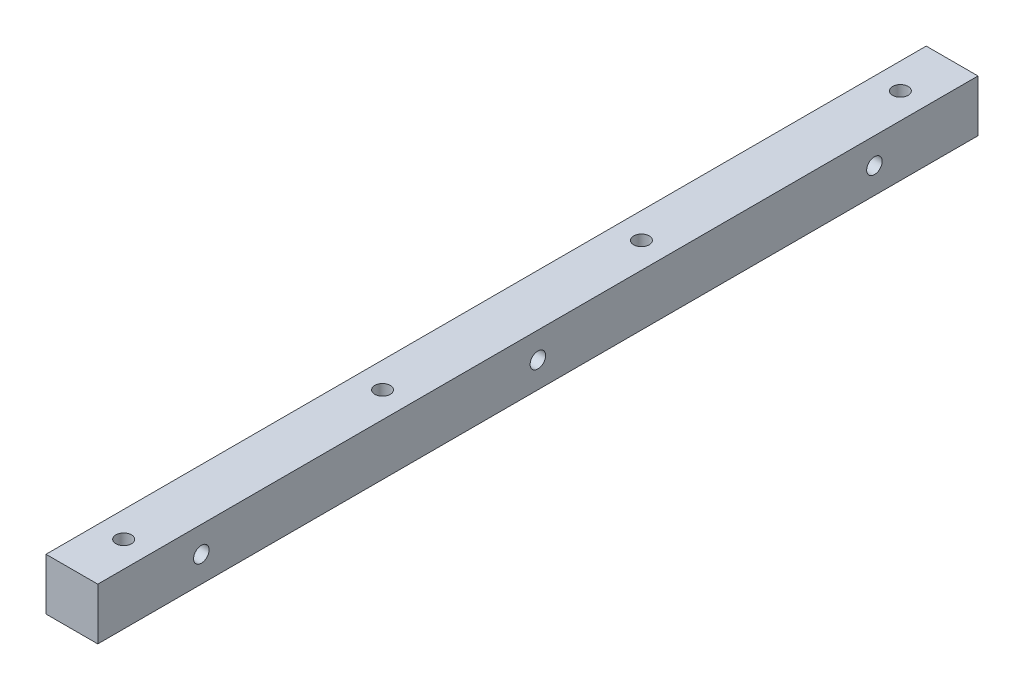
from build123d import *

# Parameters (mm, degrees)
SKETCH1_W          = 10
SKETCH1_H          = 10
EXTRUDE1_DEPTH     = 170
SKETCH4_R          = 1.5
CUT_EXTRUDE3_DEPTH = 171.587221092
LPATTERN1_COUNT    = 4
LPATTERN1_PITCH    = 50
SKETCH5_R          = 1.5
CUT_EXTRUDE4_DEPTH = 171.587221092


with BuildPart() as part:
    # Sketch1 → Extrude1 (new body)
    with BuildSketch(Plane.XY):
        with Locations((5, 5)):
            Rectangle(SKETCH1_W, SKETCH1_H)
    extrude(amount=EXTRUDE1_DEPTH)

    # Sketch4 → Cut-Extrude3 (cut, through all)
    with BuildSketch(Plane(origin=(0, 10, 0), x_dir=(-1, 0, 0), z_dir=(0, 1, 0))):
        with Locations(Location((-5, 10, 0), (0, 0, 90))):
            Circle(SKETCH4_R)
    cut_extrude3 = extrude(amount=-CUT_EXTRUDE3_DEPTH, mode=Mode.SUBTRACT)

    # LPattern1: Cut-Extrude3 ×4
    with Locations(*[(0, 0, i * LPATTERN1_PITCH) for i in range(1, LPATTERN1_COUNT)]):
        add(cut_extrude3, mode=Mode.SUBTRACT)

    # Sketch5 → Cut-Extrude4 (cut, through all)
    with BuildSketch(Plane.ZY):
        with Locations((20, 5)):
            Circle(SKETCH5_R)
        with Locations((85, 5)):
            Circle(SKETCH5_R)
        with Locations((150, 5)):
            Circle(SKETCH5_R)
    extrude(amount=-CUT_EXTRUDE4_DEPTH, mode=Mode.SUBTRACT)


solid = part.part
